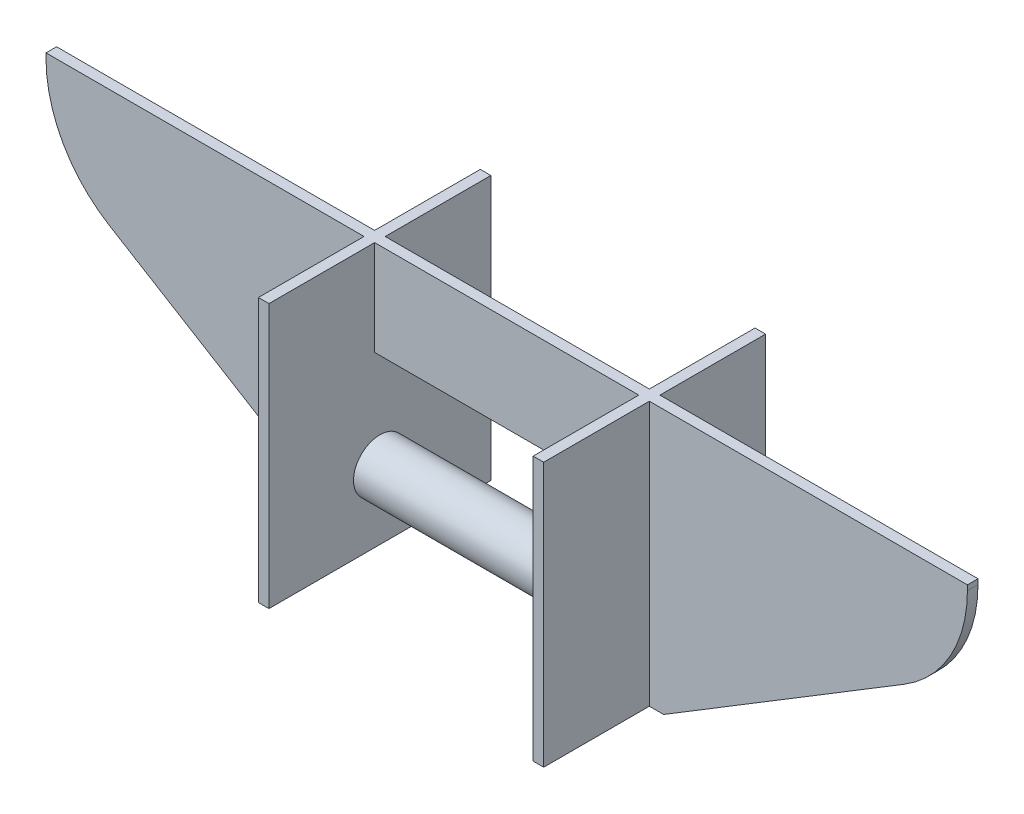
from build123d import *

# Parameters (mm, degrees)
BOSS_EXTRUDE1_DEPTH      = 2.54
BOSS_EXTRUDE1_DEPTH_BACK = 2.54
BOSS_EXTRUDE2_DEPTH      = 50.8
BOSS_EXTRUDE2_DEPTH_BACK = 55.88
SKETCH3_W                = 5.08
SKETCH3_H                = 127
BOSS_EXTRUDE3_REACH      = 318.532
SKETCH4_R                = 12.7


with BuildPart() as part:
    # Sketch2 → Boss-Extrude1 (new, two sides: drawn at the far end of the back side and taken through both)
    with BuildSketch(Plane.XY.offset(-BOSS_EXTRUDE1_DEPTH_BACK)):
        with BuildLine():
            Line((-114.3, 0), (-126.238, 0))
            Line((-126.238, 0), (-241.804631128, 70.344905904))
            ThreePointArc((-241.804631128, 70.344905904), (-264.145050484, 93.476275329), (-272.288, 124.586514185))
            Line((-272.288, 124.586514185), (-272.288, 127))
            Line((-272.288, 127), (170.688, 127))
            Line((170.688, 127), (170.688, 124.586514185))
            ThreePointArc((170.688, 124.586514185), (162.545050484, 93.476275329), (140.204631128, 70.344905904))
            Line((140.204631128, 70.344905904), (24.638, 0))
            Line((24.638, 0), (12.7, 0))
            Line((12.7, 0), (12.7, 81.28))
            Line((12.7, 81.28), (-114.3, 81.28))
            Line((-114.3, 81.28), (-114.3, 0))
        make_face()
    extrude(amount=BOSS_EXTRUDE1_DEPTH + BOSS_EXTRUDE1_DEPTH_BACK)

    # Sketch3 → Boss-Extrude2 (add, two sides: drawn at the far end of the back side and taken through both)
    with BuildSketch(Plane.XY.offset(2.54).offset(-BOSS_EXTRUDE2_DEPTH_BACK)):
        with Locations((-116.84, 63.5)):
            Rectangle(SKETCH3_W, SKETCH3_H)
        with Locations((15.24, 63.5)):
            Rectangle(SKETCH3_W, SKETCH3_H)
    extrude(amount=BOSS_EXTRUDE2_DEPTH + BOSS_EXTRUDE2_DEPTH_BACK)

    # Sketch4 → Boss-Extrude3 (add, up to next)
    with BuildSketch(Plane(origin=(-114.3, 0, 0), x_dir=(0, 0, -1), z_dir=(1, 0, 0)), mode=Mode.PRIVATE) as boss_extrude3_sk1:
        with Locations((0, 33.02)):
            Circle(SKETCH4_R)
    boss_extrude3_tool1 = extrude(boss_extrude3_sk1.sketch, amount=BOSS_EXTRUDE3_REACH, mode=Mode.PRIVATE) - part.part
    add(boss_extrude3_tool1.solids().sort_by_distance((-114.3, 33.02, 0))[0])


solid = part.part
